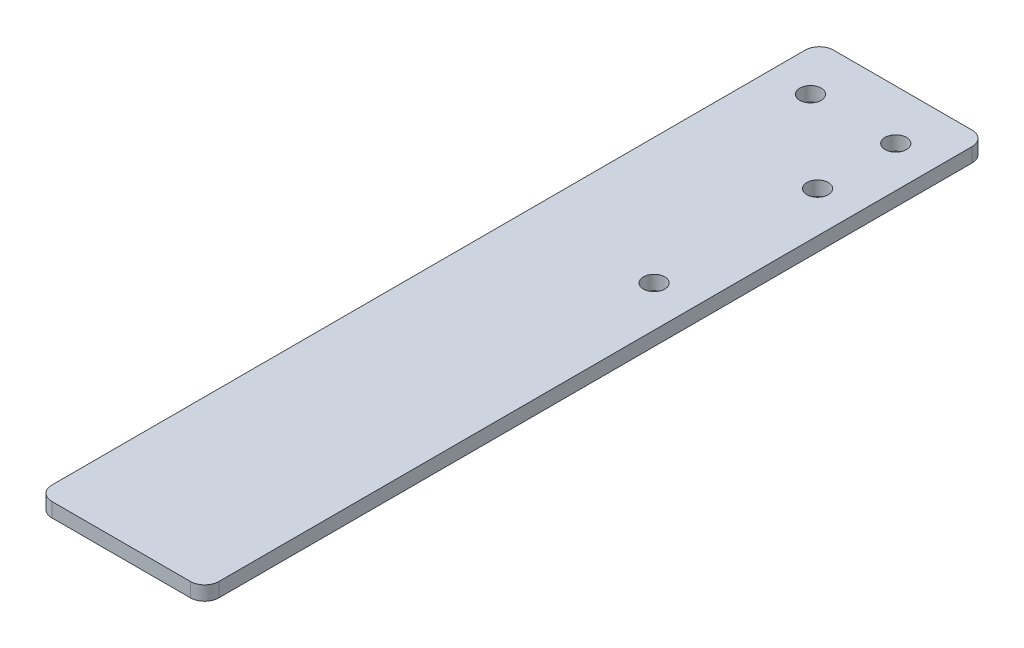
from build123d import *

# Parameters (mm, degrees)
ESQUISSE1_W             = 23.5
ESQUISSE1_H             = 2
EXTRU_MINCE1_DEPTH      = 110
ESQUISSE2_R             = 1.5
ENL_V_MAT_EXTRU_1_DEPTH = 113.5
CONG_1_R                = 2


with BuildPart() as part:
    # Esquisse1 → Extru.-Mince1 (new body)
    with BuildSketch(Plane.XY):
        with Locations((11.75, 1)):
            Rectangle(ESQUISSE1_W, ESQUISSE1_H)
    extrude(amount=EXTRU_MINCE1_DEPTH)

    # Esquisse2 → Enlèv. mat.-Extru.1 (cut, through all)
    with BuildSketch(Plane(origin=(0, 2, 0), x_dir=(1, 0, 0), z_dir=(0, 1, 0))):
        with Locations(Location((5.75, -7, 0), (0, 0, 270))):
            Circle(ESQUISSE2_R)
        with Locations(Location((17.75, -18, 0), (0, 0, 270))):
            Circle(ESQUISSE2_R)
        with Locations(Location((17.75, -41, 0), (0, 0, 270))):
            Circle(ESQUISSE2_R)
        with Locations(Location((17.75, -7, 0), (0, 0, 90))):
            Circle(ESQUISSE2_R)
    extrude(amount=-ENL_V_MAT_EXTRU_1_DEPTH, mode=Mode.SUBTRACT)

    # Congé1
    cong_1_edges = [part.edges().sort_by_distance(p)[0] for p in [
        (0, 1, 110),
        (0, 1, 0),
        (23.5, 1, 0),
        (23.5, 1, 110),
    ]]
    fillet(cong_1_edges, radius=CONG_1_R)


solid = part.part
